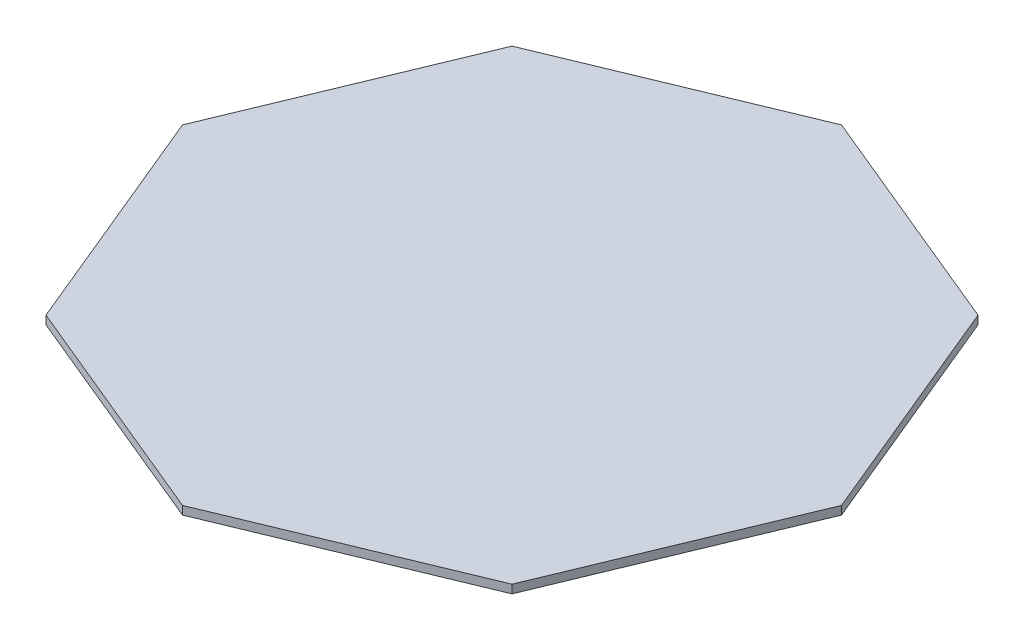
from build123d import *

# Parameters (mm, degrees)
BOSS_EXTRUDE1_DEPTH = 2


with BuildPart() as part:
    # Sketch1 → Boss-Extrude1 (new body)
    with BuildSketch(Plane(origin=(0, 0, 0), x_dir=(1, 0, 0), z_dir=(0, 1, 0))):
        Polygon((78.473434521, 0), (55.489097693, 55.489097693), (0, 78.473434521), (-55.489097693, 55.489097693), (-78.473434521, 0), (-55.489097693, -55.489097693), (0, -78.473434521), (55.489097693, -55.489097693), align=None)
    extrude(amount=BOSS_EXTRUDE1_DEPTH)


solid = part.part
